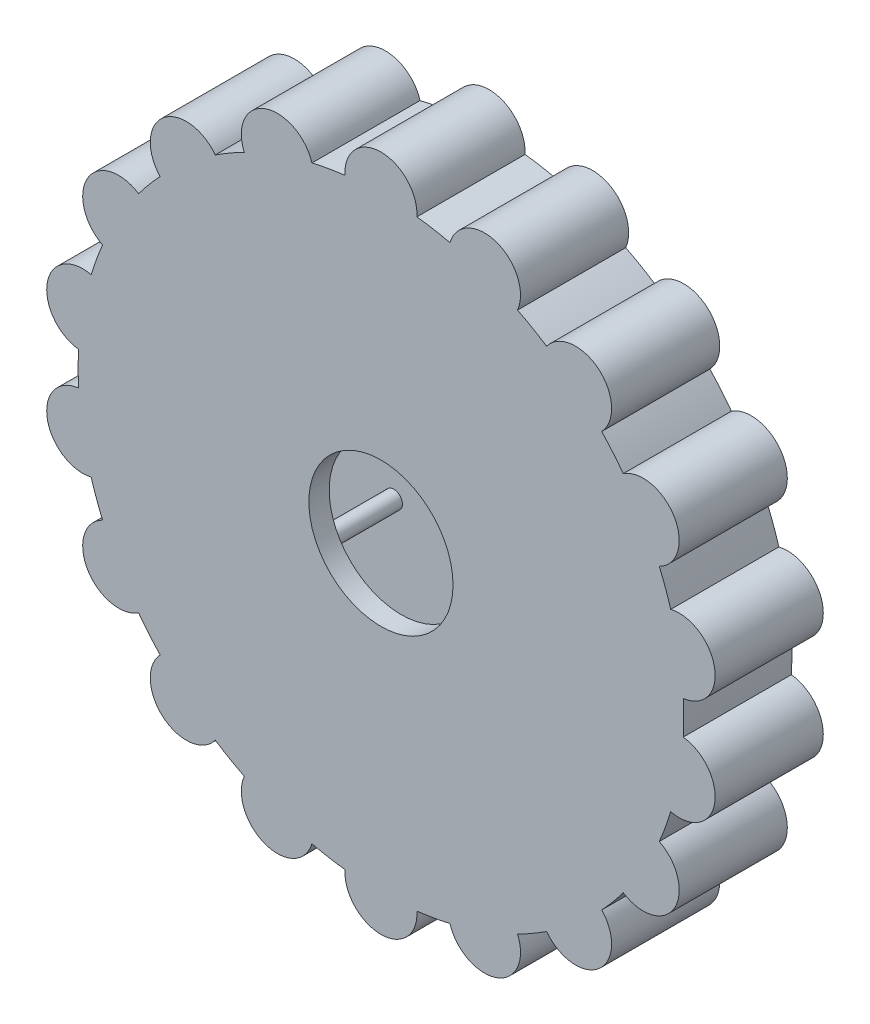
from build123d import *

# Parameters (mm, degrees)
SKETCH6_R           = 6.35
SKETCH6_R_2         = 53.34
BOSS_EXTRUDE1_DEPTH = 19.05
SKETCH10_R          = 50.8
SKETCH10_R_2        = 2.54
SKETCH10_R_3        = 1.524
CUT_EXTRUDE3_DEPTH  = 5.9436
CUT_EXTRUDE4_REACH  = 87.98
SKETCH11_R          = 12.7


with BuildPart() as part:
    # Sketch6 → Boss-Extrude1 (new body)
    with BuildSketch(Plane.XY):
        with Locations((-18.243354445, 50.123204393)):
            Circle(SKETCH6_R)
        Circle(SKETCH6_R_2)
        with Locations((-34.286291101, 40.860810596)):
            Circle(SKETCH6_R)
        with Locations((-46.193795038, 26.67)):
            Circle(SKETCH6_R)
        with Locations((-52.529645546, 9.262393797)):
            Circle(SKETCH6_R)
        with Locations((-52.529645546, -9.262393797)):
            Circle(SKETCH6_R)
        with Locations((-46.193795038, -26.67)):
            Circle(SKETCH6_R)
        with Locations((-34.286291101, -40.860810596)):
            Circle(SKETCH6_R)
        with Locations((-18.243354445, -50.123204393)):
            Circle(SKETCH6_R)
        with Locations((0, -53.34)):
            Circle(SKETCH6_R)
        with Locations((18.243354445, -50.123204393)):
            Circle(SKETCH6_R)
        with Locations((34.286291101, -40.860810596)):
            Circle(SKETCH6_R)
        with Locations((46.193795038, -26.67)):
            Circle(SKETCH6_R)
        with Locations((52.529645546, -9.262393797)):
            Circle(SKETCH6_R)
        with Locations((52.529645546, 9.262393797)):
            Circle(SKETCH6_R)
        with Locations((46.193795038, 26.67)):
            Circle(SKETCH6_R)
        with Locations((34.286291101, 40.860810596)):
            Circle(SKETCH6_R)
        with Locations((18.243354445, 50.123204393)):
            Circle(SKETCH6_R)
        with Locations((0, 53.34)):
            Circle(SKETCH6_R)
    extrude(amount=BOSS_EXTRUDE1_DEPTH)

    # Sketch10 → Cut-Extrude3 (cut, symmetric)
    with BuildSketch(Plane.XY.offset(9.525)):
        Circle(SKETCH10_R)
        with Locations((0, 44.45)):
            Circle(SKETCH10_R_2, mode=Mode.SUBTRACT)
        with Locations((38.494829198, 22.225)):
            Circle(SKETCH10_R_2, mode=Mode.SUBTRACT)
        with Locations((38.494829198, -22.225)):
            Circle(SKETCH10_R_2, mode=Mode.SUBTRACT)
        with Locations((0, -44.45)):
            Circle(SKETCH10_R_2, mode=Mode.SUBTRACT)
        with Locations((-38.494829198, -22.225)):
            Circle(SKETCH10_R_2, mode=Mode.SUBTRACT)
        with Locations((-38.494829198, 22.225)):
            Circle(SKETCH10_R_2, mode=Mode.SUBTRACT)
        with Locations((0, 15.24)):
            Circle(SKETCH10_R_3, mode=Mode.SUBTRACT)
        with Locations((13.198227154, -7.62)):
            Circle(SKETCH10_R_3, mode=Mode.SUBTRACT)
        with Locations((-13.198227154, -7.62)):
            Circle(SKETCH10_R_3, mode=Mode.SUBTRACT)
    extrude(amount=CUT_EXTRUDE3_DEPTH, both=True, mode=Mode.SUBTRACT)

    # Sketch11 → Cut-Extrude4 (cut, up to next)
    with BuildSketch(Plane.XY.offset(19.05), mode=Mode.PRIVATE) as cut_extrude4_sk1:
        Circle(SKETCH11_R)
    cut_extrude4_tool1 = extrude(cut_extrude4_sk1.sketch, amount=-CUT_EXTRUDE4_REACH, mode=Mode.PRIVATE) & part.part
    add(cut_extrude4_tool1.solids().sort_by_distance((0, 0, 19.05))[0], mode=Mode.SUBTRACT)


solid = part.part
